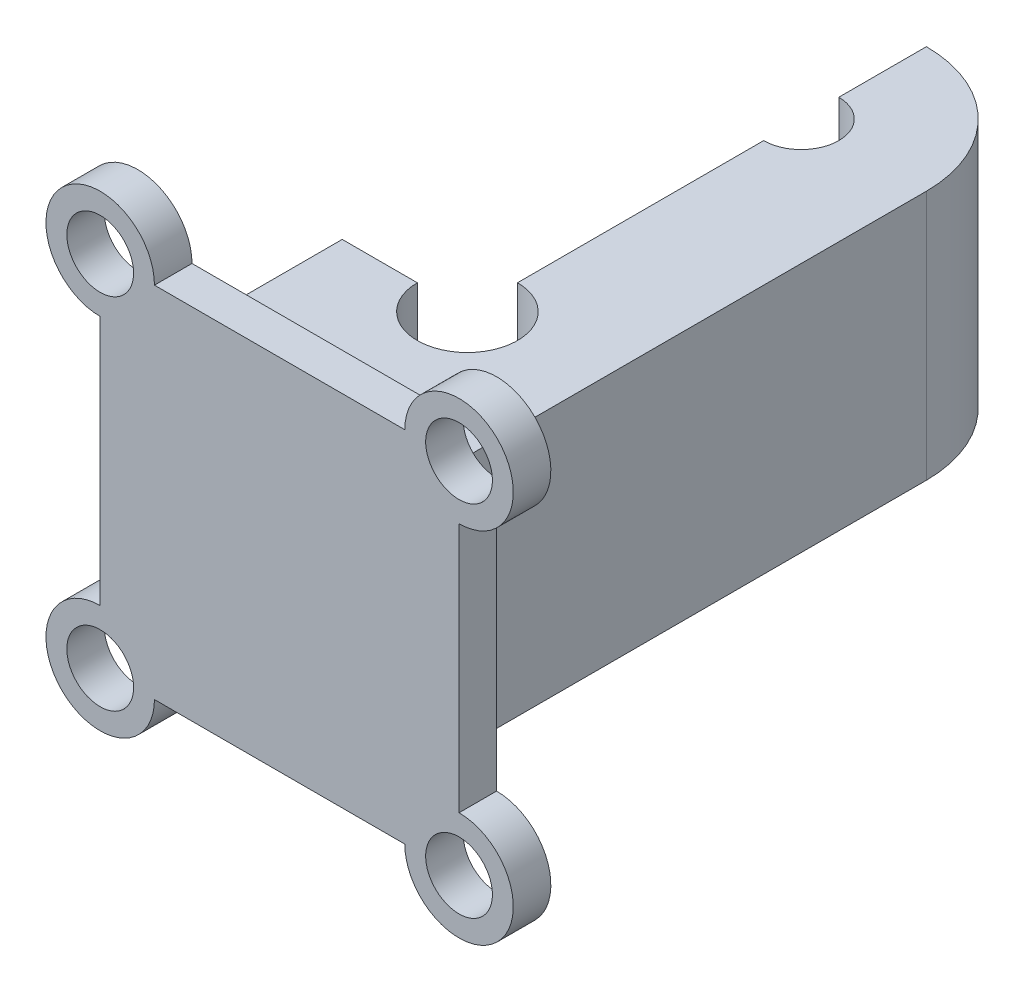
from build123d import *

# Parameters (mm, degrees)
IZIM1_R                     = 13
IZIM1_R_2                   = 8
Y_KSEKLIK_EKSTR_ZYON2_DEPTH = 9
IZIM2_W                     = 60
IZIM2_H                     = 60
Y_KSEKLIK_EKSTR_ZYON3_DEPTH = 116
Y_KSEKLIK_EKSTR_ZYON4_DEPTH = 60
IZIM4_R                     = 20
KES_EKSTR_ZYON2_DEPTH       = 220
IZIM5_R                     = 12
KES_EKSTR_ZYON3_DEPTH       = 220
KES_EKSTR_ZYON4_DEPTH       = 220
Y_KSEKLIK_EKSTR_ZYON6_DEPTH = 20
Y_KSEKLIK_EKSTR_ZYON7_DEPTH = 20
Y_KSEKLIK_EKSTR_ZYON8_DEPTH = 20
IZIM12_W                    = 9.584184826
IZIM12_H                    = 42
KES_EKSTR_ZYON5_DEPTH       = 37
IZIM13_W                    = 27.999362569
IZIM13_H                    = 42
KES_EKSTR_ZYON6_DEPTH       = 9
Y_KSEKLIK_EKSTR_ZYON9_DEPTH = 44


with BuildPart() as part:
    # Çizim1 → Yükseklik-Ekstrüzyon2 (new body)
    # profile 1 of 5: a face of its own
    with BuildSketch(Plane.XY):
        with Locations((14.305057501, -33.726417094)):
            Circle(IZIM1_R)
        with Locations((14.305057501, -33.726417094)):
            Circle(IZIM1_R_2, mode=Mode.SUBTRACT)
    # profile 2 of 5: a face of its own
    with BuildSketch(Plane.XY):
        with BuildLine():
            ThreePointArc((14.305057501, -20.726417094), (23.497445657, -24.534028939), (27.305057501, -33.726417094))
            Line((27.305057501, -33.726417094), (87.305057501, -33.726417094))
            ThreePointArc((87.305057501, -33.726417094), (91.112669346, -24.534028939), (100.305057501, -20.726417094))
            Line((100.305057501, -20.726417094), (100.305057501, 39.273582906))
            ThreePointArc((100.305057501, 39.273582906), (91.112669346, 43.08119475), (87.305057501, 52.273582906))
            Line((87.305057501, 52.273582906), (27.305057501, 52.273582906))
            ThreePointArc((27.305057501, 52.273582906), (23.497445657, 43.08119475), (14.305057501, 39.273582906))
            Line((14.305057501, 39.273582906), (14.305057501, -20.726417094))
        make_face()
    # profile 3 of 5: a face of its own
    with BuildSketch(Plane.XY):
        with Locations((100.305057501, -33.726417094)):
            Circle(IZIM1_R)
        with Locations((100.305057501, -33.726417094)):
            Circle(IZIM1_R_2, mode=Mode.SUBTRACT)
    # profile 4 of 5: a face of its own
    with BuildSketch(Plane.XY):
        with Locations((100.305057501, 52.273582906)):
            Circle(IZIM1_R)
        with Locations((100.305057501, 52.273582906)):
            Circle(IZIM1_R_2, mode=Mode.SUBTRACT)
    # profile 5 of 5: a face of its own
    with BuildSketch(Plane.XY):
        with Locations((14.305057501, 52.273582906)):
            Circle(IZIM1_R)
        with Locations((14.305057501, 52.273582906)):
            Circle(IZIM1_R_2, mode=Mode.SUBTRACT)
    extrude(amount=Y_KSEKLIK_EKSTR_ZYON2_DEPTH)

    # Çizim2 → Yükseklik-Ekstrüzyon3 (add)
    with BuildSketch(Plane(origin=(0, 0, 0), x_dir=(-1, 0, 0), z_dir=(0, 0, -1))):
        with Locations((-57.305057501, 9.273582906)):
            Rectangle(IZIM2_W, IZIM2_H)
    extrude(amount=Y_KSEKLIK_EKSTR_ZYON3_DEPTH)

    # Çizim3 → Yükseklik-Ekstrüzyon4 (add)
    with BuildSketch(Plane.XZ.offset(20.726417094)):
        with BuildLine():
            ThreePointArc((27.305057501, -116), (57.305057501, -146), (87.305057501, -116))
            Line((87.305057501, -116), (67.305057501, -116))
            ThreePointArc((67.305057501, -116), (57.305057501, -126), (47.305057501, -116))
            Line((47.305057501, -116), (27.305057501, -116))
        make_face()
    extrude(amount=-Y_KSEKLIK_EKSTR_ZYON4_DEPTH)

    # Çizim4 → Kes-Ekstrüzyon2 (cut)
    with BuildSketch(Plane.XZ.offset(20.726417094)):
        with Locations(Location((57.305057501, -116, 0), (0, 0, 270))):
            Circle(IZIM4_R)
    extrude(amount=-KES_EKSTR_ZYON2_DEPTH, mode=Mode.SUBTRACT)

    # Çizim5 → Kes-Ekstrüzyon3 (cut)
    with BuildSketch(Plane.XZ.offset(20.726417094)):
        with Locations(Location((57.305057501, -36, 0), (0, 0, 270))):
            Circle(IZIM5_R)
    extrude(amount=-KES_EKSTR_ZYON3_DEPTH, mode=Mode.SUBTRACT)

    # Çizim6 → Kes-Ekstrüzyon4 (cut)
    with BuildSketch(Plane(origin=(0, -20.726417094, 0), x_dir=(-1, 0, 0), z_dir=(0, -1, 0))):
        with BuildLine():
            ThreePointArc((-27.305057501, 116), (-36.091854066, 137.213203436), (-57.305057501, 146))
            Line((-57.305057501, 146), (-57.305057501, 136))
            ThreePointArc((-57.305057501, 136), (-43.162921878, 130.142135624), (-37.305057501, 116))
            ThreePointArc((-37.305057501, 116), (-43.162921878, 101.857864376), (-57.305057501, 96))
            Line((-57.305057501, 96), (-57.305057501, 48))
            ThreePointArc((-57.305057501, 48), (-48.819776127, 44.485281374), (-45.305057501, 36))
            Line((-45.305057501, 36), (-27.305057501, 36))
            Line((-27.305057501, 36), (-27.305057501, 116))
        make_face()
    extrude(amount=-KES_EKSTR_ZYON4_DEPTH, mode=Mode.SUBTRACT)



with BuildPart() as body_2:
    # Çizim7 → Yükseklik-Ekstrüzyon6 (new body)
    with BuildSketch(Plane(origin=(0, -0.726417094, 0), x_dir=(-1, 0, 0), z_dir=(0, -1, 0))):
        with BuildLine():
            Line((-57.305057501, 131.175251222), (-57.305057501, 135.999344695))
            ThreePointArc((-57.305057501, 135.999344695), (-77.304402197, 116), (-57.305057501, 96.000655305))
            Line((-57.305057501, 96.000655305), (-57.305057501, 100.824748778))
            ThreePointArc((-57.305057501, 100.824748778), (-72.480308724, 116), (-57.305057501, 131.175251222))
        make_face()
    extrude(amount=-Y_KSEKLIK_EKSTR_ZYON6_DEPTH)


with BuildPart() as part_1:
    add(part.part)

    add(body_2.part)  # Yükseklik-Ekstrüzyon7 merges body 2
    # Çizim10 → Yükseklik-Ekstrüzyon7 (add)
    with BuildSketch(Plane(origin=(0, 19.273582906, 0), x_dir=(-1, 0, 0), z_dir=(0, -1, 0))):
        with BuildLine():
            Line((-57.305057501, 96), (-57.305057501, 107))
            ThreePointArc((-57.305057501, 107), (-66.305057501, 116), (-57.305057501, 125))
            Line((-57.305057501, 125), (-57.305057501, 136))
            ThreePointArc((-57.305057501, 136), (-77.305057501, 116), (-57.305057501, 96))
        make_face()
    extrude(amount=-Y_KSEKLIK_EKSTR_ZYON7_DEPTH)

    # Çizim11 → Yükseklik-Ekstrüzyon8 (add)
    with BuildSketch(Plane(origin=(0, -0.726417094, 0), x_dir=(-1, 0, 0), z_dir=(0, -1, 0))):
        with BuildLine():
            Line((-57.305057501, 43), (-57.305057501, 48))
            ThreePointArc((-57.305057501, 48), (-65.790338876, 27.514718626), (-45.305057501, 36))
            Line((-45.305057501, 36), (-50.305057501, 36))
            ThreePointArc((-50.305057501, 36), (-62.25480497, 31.050252532), (-57.305057501, 43))
        make_face()
    extrude(amount=-Y_KSEKLIK_EKSTR_ZYON8_DEPTH)

    # Çizim12 → Kes-Ekstrüzyon5 (cut)
    with BuildSketch(Plane(origin=(0, 0, -36), x_dir=(-1, 0, 0), z_dir=(0, 0, -1))):
        with Locations((-32.097149914, 9.273582906)):
            Rectangle(IZIM12_W, IZIM12_H)
    extrude(amount=-KES_EKSTR_ZYON5_DEPTH, mode=Mode.SUBTRACT)

    # Çizim13 → Kes-Ekstrüzyon6 (cut)
    with BuildSketch(Plane.ZY.offset(-36.889242327)):
        with Locations((-12.999681285, 9.273582906)):
            Rectangle(IZIM13_W, IZIM13_H)
    extrude(amount=-KES_EKSTR_ZYON6_DEPTH, mode=Mode.SUBTRACT)

    # Çizim15 → Yükseklik-Ekstrüzyon9 (add)
    with BuildSketch(Plane.XZ.offset(-30.273582906)):
        with BuildLine():
            Line((45.889242327, -26.999362569), (36.889242327, -36))
            ThreePointArc((36.889242327, -36), (36.888923612, -26.999681284), (45.889242327, -26.999362569))
        make_face()
    extrude(amount=Y_KSEKLIK_EKSTR_ZYON9_DEPTH)


solid = part_1.part
